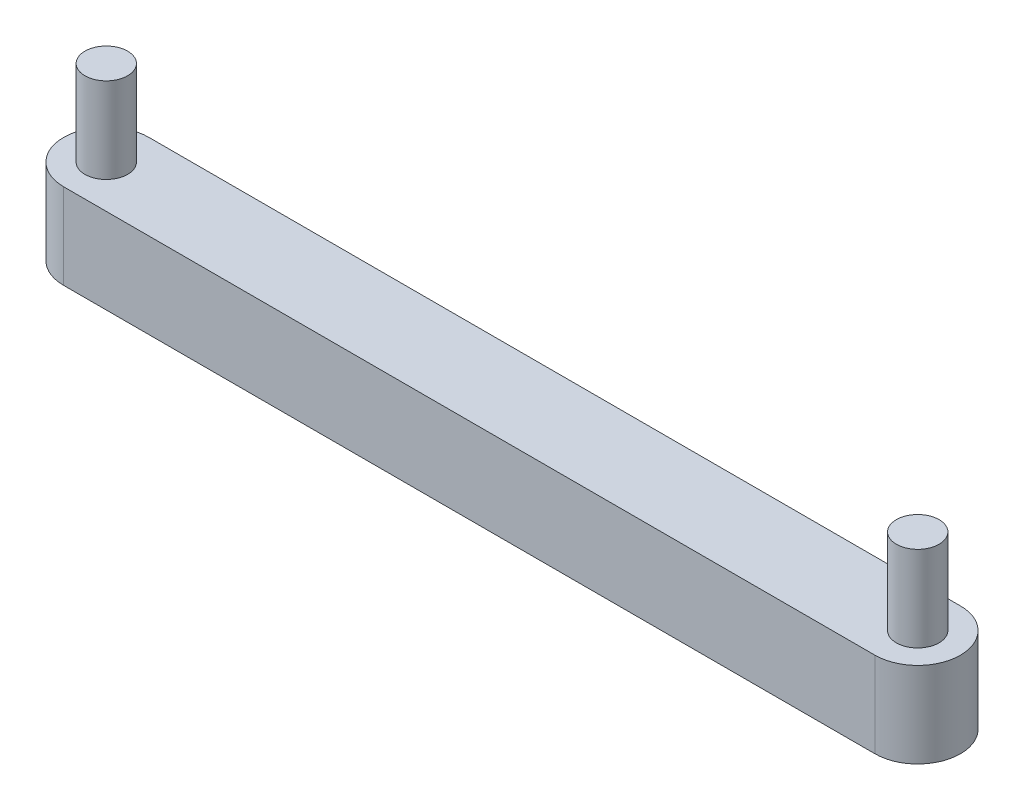
from build123d import *

# Parameters (mm, degrees)
BOSS_EXTRUDE1_DEPTH = 10
SKETCH2_R           = 2.5
BOSS_EXTRUDE2_DEPTH = 10


with BuildPart() as part:
    # Sketch1 → Boss-Extrude1 (new body)
    with BuildSketch(Plane(origin=(0, 0, 0), x_dir=(1, 0, 0), z_dir=(0, 1, 0))):
        with BuildLine():
            Line((-47.5, 5), (47.5, 5))
            ThreePointArc((47.5, 5), (52.5, 0), (47.5, -5))
            Line((47.5, -5), (-47.5, -5))
            ThreePointArc((-47.5, -5), (-52.5, 0), (-47.5, 5))
        make_face()
    extrude(amount=BOSS_EXTRUDE1_DEPTH)

    # Sketch2 → Boss-Extrude2 (add)
    with BuildSketch(Plane(origin=(0, 10, 0), x_dir=(1, 0, 0), z_dir=(0, 1, 0))):
        with Locations(Location((-47.5, 0, 0), (0, 0, 270))):
            Circle(SKETCH2_R)
        with Locations(Location((47.5, 0, 0), (0, 0, 270))):
            Circle(SKETCH2_R)
    extrude(amount=BOSS_EXTRUDE2_DEPTH)


solid = part.part
